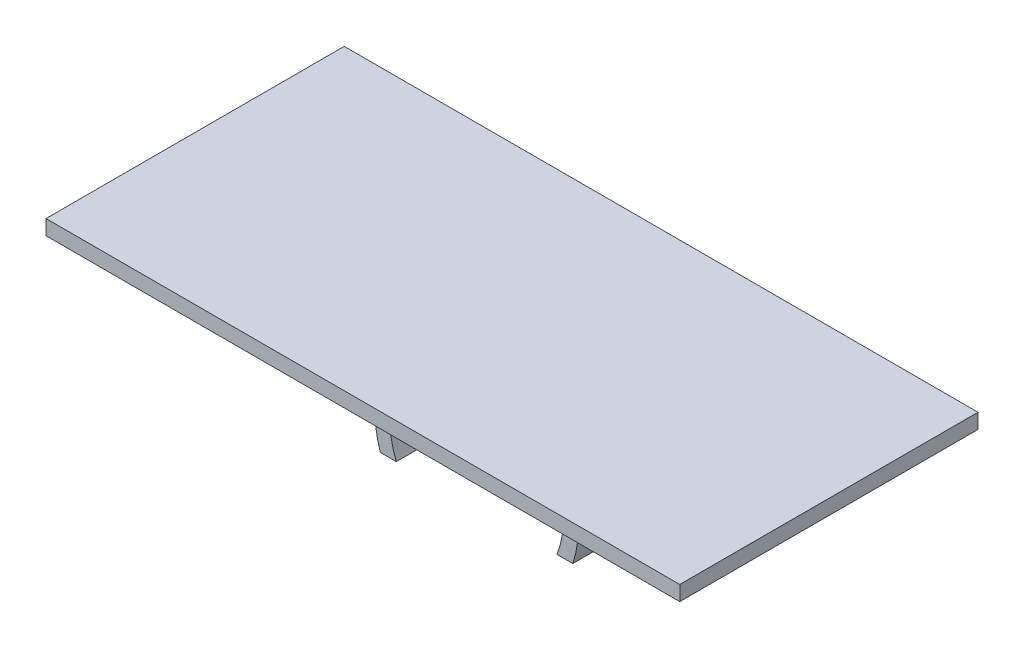
from build123d import *

# Parameters (mm, degrees)
SKETCH1_R           = 11.125
SKETCH1_R_2         = 9.125
BOSS_EXTRUDE1_DEPTH = 10
BOSS_EXTRUDE2_START = -10
BOSS_EXTRUDE2_DEPTH = 10
BOSS_EXTRUDE3_DEPTH = 40
SKETCH4_W           = 57.687127484
SKETCH4_H           = 15.25
SKETCH4_W_2         = 54.293767044
CUT_EXTRUDE1_DEPTH  = 42
SKETCH5_W           = 53.119142276
SKETCH5_H           = 26.885855795
CUT_EXTRUDE2_DEPTH  = 61


with BuildPart() as part:
    # Sketch1 → Boss-Extrude1 (new body)
    with BuildSketch(Plane.XY):
        Circle(SKETCH1_R)
        Circle(SKETCH1_R_2, mode=Mode.SUBTRACT)
    extrude(amount=BOSS_EXTRUDE1_DEPTH)

    # Sketch2 → Boss-Extrude2 (add)
    with BuildSketch(Plane.XY.offset(10).offset(BOSS_EXTRUDE2_START)):
        with BuildLine():
            Line((-9.125, -9.125), (-6.363961031, -9.125))
            ThreePointArc((-6.363961031, -9.125), (-7.866562941, -7.866562941), (-9.125, -6.363961031))
            Line((-9.125, -6.363961031), (-9.125, -9.125))
        make_face()
        with BuildLine():
            Line((-9.125, -11.125), (0, -11.125))
            ThreePointArc((0, -11.125), (-3.335416016, -10.613228774), (-6.363961031, -9.125))
            Line((-6.363961031, -9.125), (-9.125, -9.125))
            Line((-9.125, -9.125), (-9.125, -11.125))
        make_face()
        with BuildLine():
            Line((0, -11.125), (9.125, -11.125))
            Line((9.125, -11.125), (9.125, -9.125))
            Line((9.125, -9.125), (6.363961031, -9.125))
            ThreePointArc((6.363961031, -9.125), (3.335416016, -10.613228774), (0, -11.125))
        make_face()
        with BuildLine():
            Line((6.363961031, -9.125), (9.125, -9.125))
            Line((9.125, -9.125), (9.125, -6.363961031))
            ThreePointArc((9.125, -6.363961031), (7.866562941, -7.866562941), (6.363961031, -9.125))
        make_face()
    extrude(amount=BOSS_EXTRUDE2_DEPTH)

    # Sketch5 → Cut-Extrude2 (cut)
    with BuildSketch(Plane.XZ.offset(-13.625)):
        with Locations((1.239881699, 2.094817028)):
            Rectangle(SKETCH5_W, SKETCH5_H)
    extrude(amount=CUT_EXTRUDE2_DEPTH, mode=Mode.SUBTRACT)


with BuildPart() as body_2:
    # Sketch3 → Boss-Extrude3 (new body)
    with BuildSketch(Plane.XY.offset(10)):
        with BuildLine():
            Line((12.903487901, -4.375), (10.770329614, -4.375))
            ThreePointArc((10.770329614, -4.375), (0, 11.625), (-10.770329614, -4.375))
            Line((-10.770329614, -4.375), (-12.903487901, -4.375))
            ThreePointArc((-12.903487901, -4.375), (-13.584322253, 1.05205225), (-12.076010524, 6.309563758))
            ThreePointArc((-12.076010524, 6.309563758), (-12.231057843, 11.215638801), (-16.507574019, 13.625))
            Line((-16.507574019, 13.625), (-42.5, 13.625))
            Line((-42.5, 13.625), (-42.5, 15.625))
            Line((-42.5, 15.625), (42.5, 15.625))
            Line((42.5, 15.625), (42.5, 13.625))
            Line((42.5, 13.625), (16.507574019, 13.625))
            ThreePointArc((16.507574019, 13.625), (12.231057843, 11.215638801), (12.076010524, 6.309563758))
            ThreePointArc((12.076010524, 6.309563758), (13.584322253, 1.05205225), (12.903487901, -4.375))
        make_face()
    extrude(amount=BOSS_EXTRUDE3_DEPTH)

    # Sketch4 → Cut-Extrude1 (cut)
    with BuildSketch(Plane.XZ.offset(-13.625)):
        with Locations((1.827194083, 42.375)):
            Rectangle(SKETCH4_W, SKETCH4_H)
        with Locations((0.130513863, 17.625)):
            Rectangle(SKETCH4_W_2, SKETCH4_H)
    extrude(amount=CUT_EXTRUDE1_DEPTH, mode=Mode.SUBTRACT)


solid = body_2.part
